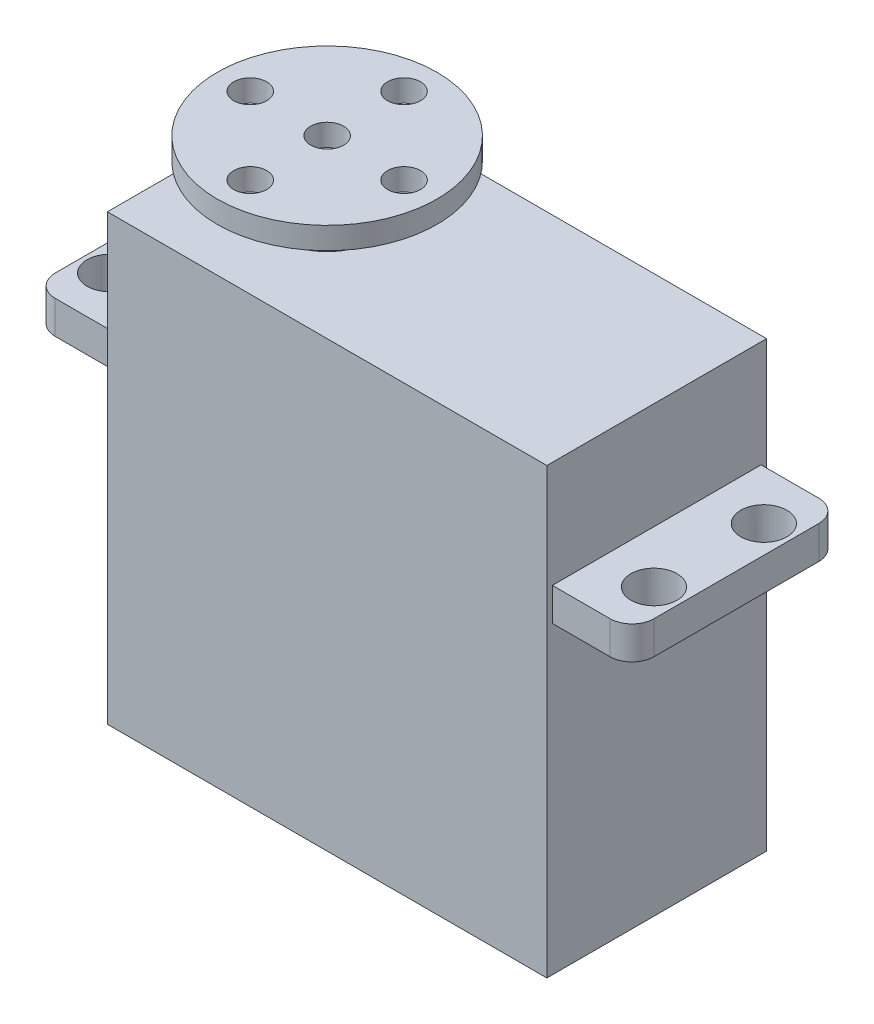
from build123d import *

# Parameters (mm, degrees)
SKETCH_1_W          = 40
SKETCH_1_H          = 27.7
EXTRUDE_1_DEPTH     = 10
SKETCH_3_W          = 54.5
SKETCH_3_H          = 19
SKETCH_3_W_2        = 40
SKETCH_3_H_2        = 20
EXTRUDE_2_DEPTH     = 3
FILLET_1_R          = 2
SKETCH_4_W          = 40
SKETCH_4_H          = 20
EXTRUDE_3_DEPTH     = 9.7
SKETCH_5_R          = 2.1
CUT_EXTRUDE_1_DEPTH = 43.249881657
SKETCH_6_R          = 4.45
EXTRUDE_4_DEPTH     = 4
SKETCH_8_R          = 10
SKETCH_8_R_2        = 1.5
EXTRUDE_5_DEPTH     = 2


with BuildPart() as part:
    # 草图1 → 凸台-拉伸1 (new, symmetric)
    with BuildSketch(Plane.XY):
        Rectangle(SKETCH_1_W, SKETCH_1_H)
    extrude(amount=EXTRUDE_1_DEPTH, both=True)

    # 草图3 → 凸台-拉伸2 (add)
    with BuildSketch(Plane(origin=(0, 13.85, 0), x_dir=(1, 0, 0), z_dir=(0, 1, 0))):
        Rectangle(SKETCH_3_W, SKETCH_3_H)
        Rectangle(SKETCH_3_W_2, SKETCH_3_H_2)
    extrude(amount=EXTRUDE_2_DEPTH)

    # 圆角1
    fillet_1_edges = [part.edges().sort_by_distance(p)[0] for p in [
        (27.25, 15.35, 9.5),
        (27.25, 15.35, -9.5),
        (-27.25, 15.35, -9.5),
        (-27.25, 15.35, 9.5),
    ]]
    fillet(fillet_1_edges, radius=FILLET_1_R)

    # 草图4 → 凸台-拉伸3 (add)
    with BuildSketch(Plane(origin=(0, 16.85, 0), x_dir=(1, 0, 0), z_dir=(0, 1, 0))):
        Rectangle(SKETCH_4_W, SKETCH_4_H)
    extrude(amount=EXTRUDE_3_DEPTH)

    # 草图5 → 切除-拉伸1 (cut, through all)
    with BuildSketch(Plane(origin=(0, 16.85, 0), x_dir=(1, 0, 0), z_dir=(0, 1, 0))):
        with Locations(Location((-24.75, 5, 0), (0, 0, 270))):
            Circle(SKETCH_5_R)
        with Locations(Location((-24.75, -5, 0), (0, 0, 270))):
            Circle(SKETCH_5_R)
        with Locations(Location((24.75, -5, 0), (0, 0, 270))):
            Circle(SKETCH_5_R)
        with Locations(Location((24.75, 5, 0), (0, 0, 270))):
            Circle(SKETCH_5_R)
    extrude(amount=-CUT_EXTRUDE_1_DEPTH, mode=Mode.SUBTRACT)

    # 草图6 → 凸台-拉伸4 (add)
    with BuildSketch(Plane(origin=(0, 26.55, 0), x_dir=(1, 0, 0), z_dir=(0, 1, 0))):
        with Locations(Location((-10, 0, 0), (0, 0, 270))):
            Circle(SKETCH_6_R)
    extrude(amount=EXTRUDE_4_DEPTH)


with BuildPart() as body_2:
    # 草图8 → 凸台-拉伸5 (new body)
    with BuildSketch(Plane(origin=(0, 30.55, 0), x_dir=(1, 0, 0), z_dir=(0, 1, 0))):
        with Locations(Location((-10, 0, 0), (0, 0, 270))):
            Circle(SKETCH_8_R)
        with Locations(Location((-10, 7, 0), (0, 0, 270))):
            Circle(SKETCH_8_R_2, mode=Mode.SUBTRACT)
        with Locations(Location((-3, 0, 0), (0, 0, 270))):
            Circle(SKETCH_8_R_2, mode=Mode.SUBTRACT)
        with Locations(Location((-10, -7, 0), (0, 0, 270))):
            Circle(SKETCH_8_R_2, mode=Mode.SUBTRACT)
        with Locations(Location((-17, 0, 0), (0, 0, 270))):
            Circle(SKETCH_8_R_2, mode=Mode.SUBTRACT)
        with Locations(Location((-10, 0, 0), (0, 0, 270))):
            Circle(SKETCH_8_R_2, mode=Mode.SUBTRACT)
    extrude(amount=EXTRUDE_5_DEPTH)


solid = Compound([part.part, body_2.part])
